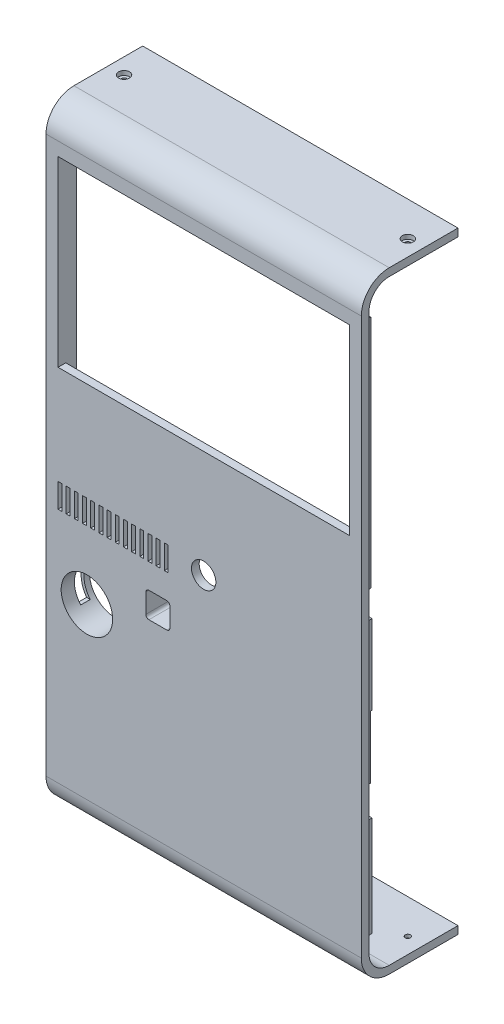
from build123d import *

# Parameters (mm, degrees)
SALIENTE_EXTRUIR1_DEPTH    = 131.1
CROQUIS3_R                 = 1.1
CORTAR_EXTRUIR1_DEPTH      = 289.575068223
CROQUIS4_R                 = 10.7
CROQUIS4_R_2               = 5.07
CROQUIS4_W                 = 121.1
CROQUIS4_H                 = 75.8
CROQUIS4_W_2               = 1.6
CROQUIS4_H_2               = 10
CROQUIS4_W_3               = 10
CROQUIS4_H_3               = 10.6
CORTAR_EXTRUIR2_DEPTH      = 287.189954401
CROQUIS7_W                 = 1.36
CROQUIS7_H                 = 98
CROQUIS7_W_2               = 1.86
CROQUIS7_H_2               = 41.6
SALIENTE_EXTRUIR2_DEPTH    = 4.4
CROQUIS8_R                 = 2.27
CORTAR_EXTRUIR3_DEPTH      = 1.8
CORTAR_EXTRUIR4_START      = -1.8
CROQUIS9_R                 = 2.27
CORTAR_EXTRUIR4_DEPTH      = 1.8
CROQUIS10_R                = 11.9
CROQUIS10_R_2              = 10.7
CROQUIS10_W                = 12.4
CROQUIS10_H                = 13
CROQUIS10_W_2              = 10
CROQUIS10_H_2              = 10.6
SALIENTE_EXTRUIR4_DEPTH    = 8.6
REDONDEO2_R                = 1.28
CORTAR_EXTRUIR5_REACH      = 292.482
CORTAR_EXTRUIR5_END_RADIUS = 10.7
CROQUIS11_W                = 4
CROQUIS11_H                = 14
SALIENTE_EXTRUIR6_START    = 1
CROQUIS13_W                = 12.4
CROQUIS13_H                = 13
SALIENTE_EXTRUIR6_DEPTH    = 1
CROQUIS14_R                = 2.8
CROQUIS14_R_2              = 1.5
SALIENTE_EXTRUIR7_DEPTH    = 8.4
REDONDEO3_R                = 1.28
CROQUIS17_W                = 4.4
CROQUIS17_H                = 0.4
CORTAR_EXTRUIR6_DEPTH      = 285.106479335
REDONDEO4_R                = 1.6
CROQUIS19_R                = 1.12
SALIENTE_EXTRUIR8_DEPTH    = 8.6
REDONDEO5_R                = 1
CORTAR_EXTRUIR8_START      = -1.86
CROQUIS21_W                = 0.6
CROQUIS21_H                = 26
CORTAR_EXTRUIR8_DEPTH      = 1.86
CROQUIS23_W                = 121.1
CROQUIS23_H                = 0.1
CORTAR_EXTRUIR9_DEPTH      = 287.189954401


with BuildPart() as part:
    # Croquis2 → Saliente-Extruir1 (new body)
    with BuildSketch(Plane(origin=(0, 0, 0), x_dir=(0, 0, -1), z_dir=(1, 0, 0))):
        with BuildLine():
            Line((37, 0), (37, -3.2))
            Line((37, -3.2), (8.4, -3.2))
            ThreePointArc((8.4, -3.2), (0.197561338, 0.197561338), (-3.2, 8.4))
            Line((-3.2, 8.4), (-3.2, 239.6))
            ThreePointArc((-3.2, 239.6), (0.197561338, 247.802438662), (8.4, 251.2))
            Line((8.4, 251.2), (37, 251.2))
            Line((37, 251.2), (37, 248))
            Line((37, 248), (8.4, 248))
            ThreePointArc((8.4, 248), (2.460303038, 245.539696962), (0, 239.6))
            Line((0, 239.6), (0, 8.4))
            ThreePointArc((0, 8.4), (2.460303038, 2.460303038), (8.4, 0))
            Line((8.4, 0), (37, 0))
        make_face()
    extrude(amount=SALIENTE_EXTRUIR1_DEPTH)

    # Croquis3 → Cortar-Extruir1 (cut, through all)
    with BuildSketch(Plane(origin=(0, 251.2, 0), x_dir=(1, 0, 0), z_dir=(0, 1, 0))):
        with Locations(Location((6.55, 22.7, 0), (0, 0, 270))):
            Circle(CROQUIS3_R)
        with Locations(Location((124.55, 22.7, 0), (0, 0, 270))):
            Circle(CROQUIS3_R)
    extrude(amount=-CORTAR_EXTRUIR1_DEPTH, mode=Mode.SUBTRACT)

    # Croquis4 → Cortar-Extruir2 (cut, through all)
    with BuildSketch(Plane.XY.offset(3.2)):
        with Locations((17, 78.7)):
            Circle(CROQUIS4_R)
        with Locations((65.55, 113.5)):
            Circle(CROQUIS4_R_2)
        with Locations((65.55, 196.1)):
            Rectangle(CROQUIS4_W, CROQUIS4_H)
        with Locations((9.2, 112)):
            Rectangle(CROQUIS4_W_2, CROQUIS4_H_2)
        with Locations((46.5, 91.4)):
            Rectangle(CROQUIS4_W_3, CROQUIS4_H_3)
        with Locations((5.8, 112)):
            Rectangle(CROQUIS4_W_2, CROQUIS4_H_2)
        with Locations((12.6, 112)):
            Rectangle(CROQUIS4_W_2, CROQUIS4_H_2)
        with Locations((16, 112)):
            Rectangle(CROQUIS4_W_2, CROQUIS4_H_2)
        with Locations((19.4, 112)):
            Rectangle(CROQUIS4_W_2, CROQUIS4_H_2)
        with Locations((22.8, 112)):
            Rectangle(CROQUIS4_W_2, CROQUIS4_H_2)
        with Locations((26.2, 112)):
            Rectangle(CROQUIS4_W_2, CROQUIS4_H_2)
        with Locations((29.6, 112)):
            Rectangle(CROQUIS4_W_2, CROQUIS4_H_2)
        with Locations((33, 112)):
            Rectangle(CROQUIS4_W_2, CROQUIS4_H_2)
        with Locations((36.4, 112)):
            Rectangle(CROQUIS4_W_2, CROQUIS4_H_2)
        with Locations((39.8, 112)):
            Rectangle(CROQUIS4_W_2, CROQUIS4_H_2)
        with Locations((43.2, 112)):
            Rectangle(CROQUIS4_W_2, CROQUIS4_H_2)
        with Locations((46.6, 112)):
            Rectangle(CROQUIS4_W_2, CROQUIS4_H_2)
        with Locations((50, 112)):
            Rectangle(CROQUIS4_W_2, CROQUIS4_H_2)
    extrude(amount=-CORTAR_EXTRUIR2_DEPTH, mode=Mode.SUBTRACT)

    # Croquis7 → Saliente-Extruir2 (add)
    with BuildSketch(Plane(origin=(0, 0, 0), x_dir=(-1, 0, 0), z_dir=(0, 0, -1))):
        Polygon((-127.46, 125.3), (-127.96, 125.3), (-127.96, 66.3), (-127.46, 66.3), (-126.1, 66.3), (-126.1, 125.3), align=None)
        with Locations((-126.78, 185)):
            Rectangle(CROQUIS7_W, CROQUIS7_H)
        with Locations((-4.32, 185)):
            Rectangle(CROQUIS7_W, CROQUIS7_H)
        Polygon((-3.64, 125.3), (-5, 125.3), (-5, 66.3), (-3.64, 66.3), (-3.14, 66.3), (-3.14, 125.3), align=None)
        with Locations((-127.03, 32.7)):
            Rectangle(CROQUIS7_W_2, CROQUIS7_H_2)
        with Locations((-4.07, 32.7)):
            Rectangle(CROQUIS7_W_2, CROQUIS7_H_2)
    extrude(amount=SALIENTE_EXTRUIR2_DEPTH)

    # Croquis8 → Cortar-Extruir3 (cut)
    with BuildSketch(Plane(origin=(0, 251.2, 0), x_dir=(1, 0, 0), z_dir=(0, 1, 0))):
        with Locations(Location((6.55, 22.7, 0), (0, 0, 270))):
            Circle(CROQUIS8_R)
        with Locations(Location((124.55, 22.7, 0), (0, 0, 270))):
            Circle(CROQUIS8_R)
    extrude(amount=-CORTAR_EXTRUIR3_DEPTH, mode=Mode.SUBTRACT)

    # Croquis9 → Cortar-Extruir4 (cut)
    with BuildSketch(Plane.XZ.offset(3.2).offset(CORTAR_EXTRUIR4_START)):
        with Locations(Location((124.55, -22.7, 0), (0, 0, 90))):
            Circle(CROQUIS9_R)
        with Locations(Location((6.55, -22.7, 0), (0, 0, 90))):
            Circle(CROQUIS9_R)
    extrude(amount=CORTAR_EXTRUIR4_DEPTH, mode=Mode.SUBTRACT)

    # Croquis10 → Saliente-Extruir4 (add)
    # profile 1 of 2: a face of its own
    with BuildSketch(Plane(origin=(0, 0, 0), x_dir=(-1, 0, 0), z_dir=(0, 0, -1))):
        with Locations(Location((-17, 78.7, 0), (0, 0, 180))):
            Circle(CROQUIS10_R)
        with Locations(Location((-17, 78.7, 0), (0, 0, 180))):
            Circle(CROQUIS10_R_2, mode=Mode.SUBTRACT)
    # profile 2 of 2: a face of its own
    with BuildSketch(Plane(origin=(0, 0, 0), x_dir=(-1, 0, 0), z_dir=(0, 0, -1))):
        with Locations((-46.5, 91.4)):
            Rectangle(CROQUIS10_W, CROQUIS10_H)
        with Locations((-46.5, 91.4)):
            Rectangle(CROQUIS10_W_2, CROQUIS10_H_2, mode=Mode.SUBTRACT)
    extrude(amount=SALIENTE_EXTRUIR4_DEPTH)

    # Redondeo2
    redondeo2_edges = [part.edges().sort_by_distance(p)[0] for p in [
        (41.5, 86.1, -2.7),
        (41.5, 96.7, -2.7),
        (51.5, 96.7, -2.7),
        (51.5, 86.1, -2.7),
    ]]
    fillet(redondeo2_edges, radius=REDONDEO2_R)

    # Cortar-Extruir5: up to this cylinder (the profile starts outside it)
    cortar_extruir5_end = Plane(origin=(17, 78.7, -4.3), z_dir=(0, 0, 1)) * Cylinder(CORTAR_EXTRUIR5_END_RADIUS, 607.364, mode=Mode.PRIVATE)
    # Croquis11 → Cortar-Extruir5 (cut, up to the surface)
    with BuildSketch(Plane.ZY.offset(10), mode=Mode.PRIVATE) as cortar_extruir5_sk1:
        with Locations((-4.3, 78.7)):
            Rectangle(CROQUIS11_W, CROQUIS11_H)
    cortar_extruir5_tool1 = extrude(cortar_extruir5_sk1.sketch, amount=-CORTAR_EXTRUIR5_REACH, mode=Mode.PRIVATE) - cortar_extruir5_end
    add(cortar_extruir5_tool1.solids().sort_by_distance((-10, 78.7, -4.3))[0], mode=Mode.SUBTRACT)

    # Croquis13 → Saliente-Extruir6 (add)
    with BuildSketch(Plane(origin=(0, 0, -8.6), x_dir=(-1, 0, 0), z_dir=(0, 0, -1)).offset(SALIENTE_EXTRUIR6_START)):
        with Locations((-46.5, 91.4)):
            Rectangle(CROQUIS13_W, CROQUIS13_H)
        with BuildLine():
            ThreePointArc((-50.22, 86.1), (-51.12509668, 86.47490332), (-51.5, 87.38))
            Line((-51.5, 87.38), (-51.5, 95.42))
            ThreePointArc((-51.5, 95.42), (-51.12509668, 96.32509668), (-50.22, 96.7))
            Line((-50.22, 96.7), (-42.78, 96.7))
            ThreePointArc((-42.78, 96.7), (-41.87490332, 96.32509668), (-41.5, 95.42))
            Line((-41.5, 95.42), (-41.5, 87.38))
            ThreePointArc((-41.5, 87.38), (-41.87490332, 86.47490332), (-42.78, 86.1))
            Line((-42.78, 86.1), (-50.22, 86.1))
        make_face(mode=Mode.SUBTRACT)
    extrude(amount=-SALIENTE_EXTRUIR6_DEPTH)

    # Croquis14 → Saliente-Extruir7 (add)
    with BuildSketch(Plane(origin=(0, 0, 0), x_dir=(-1, 0, 0), z_dir=(0, 0, -1))):
        with Locations(Location((-65.55, 88.8, 0), (0, 0, 180))):
            Circle(CROQUIS14_R)
        with Locations((-65.55, 88.8)):
            Circle(CROQUIS14_R_2, mode=Mode.SUBTRACT)
    extrude(amount=SALIENTE_EXTRUIR7_DEPTH)

    # Redondeo3
    redondeo3_edges = [part.edges().sort_by_distance(p)[0] for p in [
        (62.75, 88.8, 0),
    ]]
    fillet(redondeo3_edges, radius=REDONDEO3_R)

    # Croquis17 → Cortar-Extruir6 (cut, through all)
    with BuildSketch(Plane(origin=(127.46, 0, 0), x_dir=(0, 0, -1), z_dir=(1, 0, 0))):
        with Locations((2.2, 233.8)):
            Rectangle(CROQUIS17_W, CROQUIS17_H)
    extrude(amount=-CORTAR_EXTRUIR6_DEPTH, mode=Mode.SUBTRACT)

    # Redondeo4
    redondeo4_edges = [part.edges().sort_by_distance(p)[0] for p in [
        (52.7, 91.4, 0),
        (40.3, 91.4, 0),
    ]]
    fillet(redondeo4_edges, radius=REDONDEO4_R)

    # Croquis19 → Saliente-Extruir8 (add)
    with BuildSketch(Plane(origin=(0, 0, 0), x_dir=(-1, 0, 0), z_dir=(0, 0, -1))):
        with Locations((-17, 90.6)):
            Circle(CROQUIS19_R)
        with Locations((-17, 66.8)):
            Circle(CROQUIS19_R)
    extrude(amount=SALIENTE_EXTRUIR8_DEPTH)

    # Redondeo5
    redondeo5_edges = [part.edges().sort_by_distance(p)[0] for p in [
        (28.9, 78.7, 0),
    ]]
    fillet(redondeo5_edges, radius=REDONDEO5_R)

    # Croquis21 → Cortar-Extruir8 (cut)
    with BuildSketch(Plane(origin=(127.96, 0, 0), x_dir=(0, 0, -1), z_dir=(1, 0, 0)).offset(CORTAR_EXTRUIR8_START)):
        with Locations((4.1, 79.3)):
            Rectangle(CROQUIS21_W, CROQUIS21_H)
    extrude(amount=CORTAR_EXTRUIR8_DEPTH, mode=Mode.SUBTRACT)

    # Croquis23 → Cortar-Extruir9 (cut, through all)
    with BuildSketch(Plane.XY.offset(3.2)):
        with Locations((65.55, 158.15)):
            Rectangle(CROQUIS23_W, CROQUIS23_H)
    extrude(amount=-CORTAR_EXTRUIR9_DEPTH, mode=Mode.SUBTRACT)


solid = part.part
